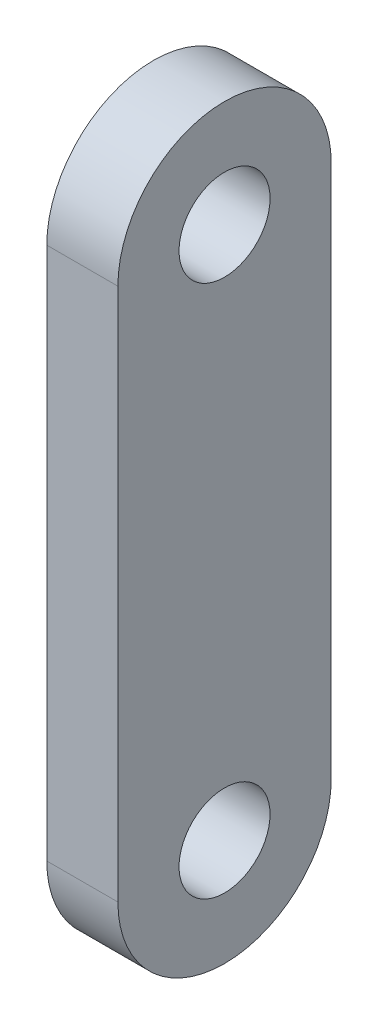
from build123d import *

# Parameters (mm, degrees)
SKETCH1_R           = 2.032
BOSS_EXTRUDE1_DEPTH = 3.175


with BuildPart() as part:
    # Sketch1 → Boss-Extrude1 (new body)
    with BuildSketch(Plane(origin=(0, 0, 0), x_dir=(0, 0, -1), z_dir=(1, 0, 0))):
        with BuildLine():
            Line((-4.7625, 0), (-4.7625, 23.8125))
            ThreePointArc((-4.7625, 23.8125), (0, 28.575), (4.7625, 23.8125))
            Line((4.7625, 23.8125), (4.7625, 0))
            ThreePointArc((4.7625, 0), (0, -4.7625), (-4.7625, 0))
        make_face()
        with Locations((0, 23.8125)):
            Circle(SKETCH1_R, mode=Mode.SUBTRACT)
        Circle(SKETCH1_R, mode=Mode.SUBTRACT)
    extrude(amount=BOSS_EXTRUDE1_DEPTH)


solid = part.part
